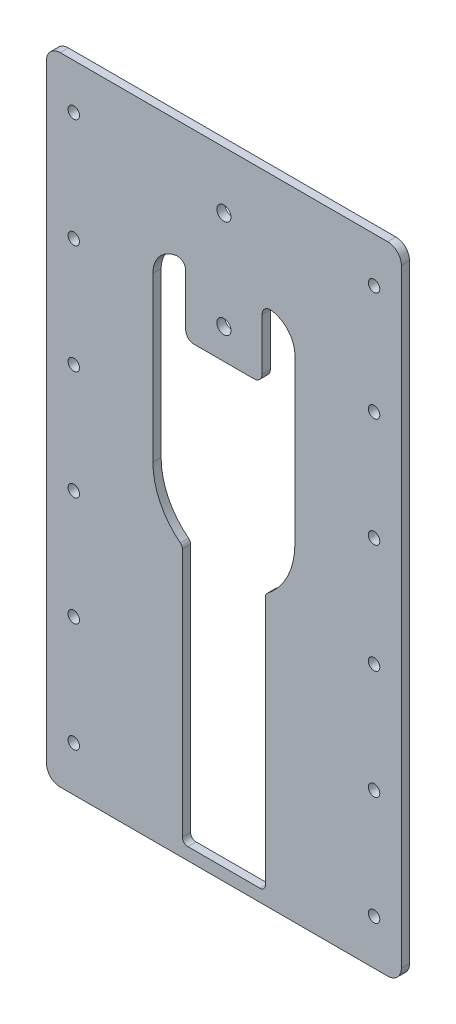
from build123d import *

# Parameters (mm, degrees)
BOSS_EXTRUDE1_DEPTH = 3
SKETCH2_W           = 107
SKETCH2_H           = 20
CUT_EXTRUDE1_DEPTH  = 143.254173928
SKETCH3_R           = 26
CUT_EXTRUDE2_DEPTH  = 143.254173928
FILLET1_R           = 5
SKETCH4_W           = 30.4
SKETCH4_H           = 116.319851171
CUT_EXTRUDE3_DEPTH  = 143.254173928
SKETCH5_W           = 52
SKETCH5_H           = 70
CUT_EXTRUDE4_DEPTH  = 143.254173928
FILLET2_R           = 10
FILLET3_R           = 2
SKETCH6_W           = 28
SKETCH6_H           = 50
BOSS_EXTRUDE2_DEPTH = 3
FILLET4_R           = 3
SKETCH7_R           = 2.1
CUT_EXTRUDE5_DEPTH  = 143.254174065
SKETCH8_R           = 2.6
CUT_EXTRUDE6_DEPTH  = 143.254174065


with BuildPart() as part:
    # Sketch1 → Boss-Extrude1 (new body)
    with BuildSketch(Plane.XY):
        Polygon((-65, 106.5), (-65, -126.5), (65, -126.5), (65, 126.5), (-42, 126.5), (-42, 106.5), align=None)
    extrude(amount=BOSS_EXTRUDE1_DEPTH)

    # Sketch2 → Cut-Extrude1 (cut, through all)
    with BuildSketch(Plane.XY.offset(3)):
        with Locations((11.5, 116.5)):
            Rectangle(SKETCH2_W, SKETCH2_H)
    extrude(amount=-CUT_EXTRUDE1_DEPTH, mode=Mode.SUBTRACT)

    # Sketch3 → Cut-Extrude2 (cut, through all)
    with BuildSketch(Plane(origin=(0, 0, 0), x_dir=(-1, 0, 0), z_dir=(0, 0, -1))):
        with Locations((0, -6.5)):
            Circle(SKETCH3_R)
    extrude(amount=-CUT_EXTRUDE2_DEPTH, mode=Mode.SUBTRACT)

    # Fillet1
    fillet1_edges = [part.edges().sort_by_distance(p)[0] for p in [
        (65, -126.5, 1.5),
        (-65, -126.5, 1.5),
        (-65, 106.5, 1.5),
        (65, 106.5, 1.5),
    ]]
    fillet(fillet1_edges, radius=FILLET1_R)

    # Sketch4 → Cut-Extrude3 (cut, through all)
    with BuildSketch(Plane.XY.offset(3)):
        with Locations((0, -63.840074415)):
            Rectangle(SKETCH4_W, SKETCH4_H)
    extrude(amount=-CUT_EXTRUDE3_DEPTH, mode=Mode.SUBTRACT)

    # Sketch5 → Cut-Extrude4 (cut, through all)
    with BuildSketch(Plane(origin=(0, 0, 0), x_dir=(-1, 0, 0), z_dir=(0, 0, -1))):
        with Locations((0, 28.5)):
            Rectangle(SKETCH5_W, SKETCH5_H)
    extrude(amount=-CUT_EXTRUDE4_DEPTH, mode=Mode.SUBTRACT)

    # Fillet2
    fillet2_edges = [part.edges().sort_by_distance(p)[0] for p in [
        (26, 63.5, 1.5),
        (-26, 63.5, 1.5),
    ]]
    fillet(fillet2_edges, radius=FILLET2_R)

    # Fillet3
    fillet3_edges = [part.edges().sort_by_distance(p)[0] for p in [
        (-15.2, -27.594074997, 1.5),
        (15.2, -27.594074997, 1.5),
        (-15.2, -122, 1.5),
        (15.2, -122, 1.5),
    ]]
    fillet(fillet3_edges, radius=FILLET3_R)

    # Sketch6 → Boss-Extrude2 (add)
    with BuildSketch(Plane(origin=(0, 0, 0), x_dir=(-1, 0, 0), z_dir=(0, 0, -1))):
        with Locations((0, 63.5)):
            Rectangle(SKETCH6_W, SKETCH6_H)
    extrude(amount=-BOSS_EXTRUDE2_DEPTH)

    # Fillet4
    fillet4_edges = [part.edges().sort_by_distance(p)[0] for p in [
        (14, 38.5, 1.5),
        (-14, 38.5, 1.5),
        (-14, 63.5, 1.5),
        (14, 63.5, 1.5),
    ]]
    fillet(fillet4_edges, radius=FILLET4_R)

    # Sketch7 → Cut-Extrude5 (cut, through all)
    with BuildSketch(Plane(origin=(0, 0, 0), x_dir=(-1, 0, 0), z_dir=(0, 0, -1))):
        with Locations((-55, 90)):
            Circle(SKETCH7_R)
        with Locations((-55, 50)):
            Circle(SKETCH7_R)
        with Locations((-55, 10)):
            Circle(SKETCH7_R)
        with Locations((-55, -30)):
            Circle(SKETCH7_R)
        with Locations((-55, -70)):
            Circle(SKETCH7_R)
        with Locations((-55, -110)):
            Circle(SKETCH7_R)
    cut_extrude5 = extrude(amount=-CUT_EXTRUDE5_DEPTH, mode=Mode.SUBTRACT)

    # Mirror1: Cut-Extrude5 across plane
    add(cut_extrude5.mirror(Plane(origin=(0, 0, 0), x_dir=(0, 0, 1), z_dir=(1, 0, 0))), mode=Mode.SUBTRACT)

    # Sketch8 → Cut-Extrude6 (cut, through all)
    with BuildSketch(Plane.XY.offset(3)):
        with Locations((-1.1e-08, 49.569851171)):
            Circle(SKETCH8_R)
        with Locations((-1.1e-08, 85.569851171)):
            Circle(SKETCH8_R)
    extrude(amount=-CUT_EXTRUDE6_DEPTH, mode=Mode.SUBTRACT)


solid = part.part
